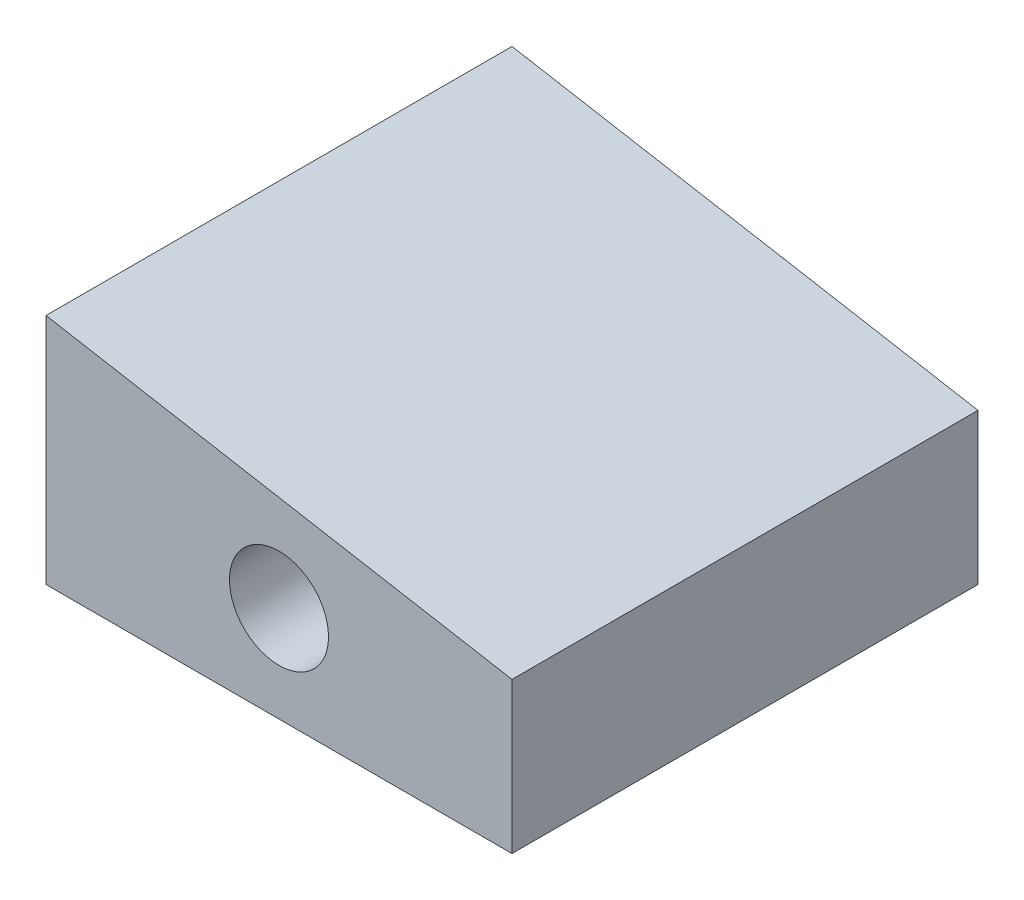
from build123d import *

# Parameters (mm, degrees)
SKETCH_1_R      = 2.125
EXTRUDE_1_DEPTH = 20


with BuildPart() as part:
    # 草图1 → 凸台-拉伸1 (new body)
    with BuildSketch(Plane.XY):
        Polygon((0, 0), (0, 10), (20, 6.473460386), (20, 0), align=None)
        with Locations((10, 4.118365096)):
            Circle(SKETCH_1_R, mode=Mode.SUBTRACT)
    extrude(amount=EXTRUDE_1_DEPTH)


solid = part.part
